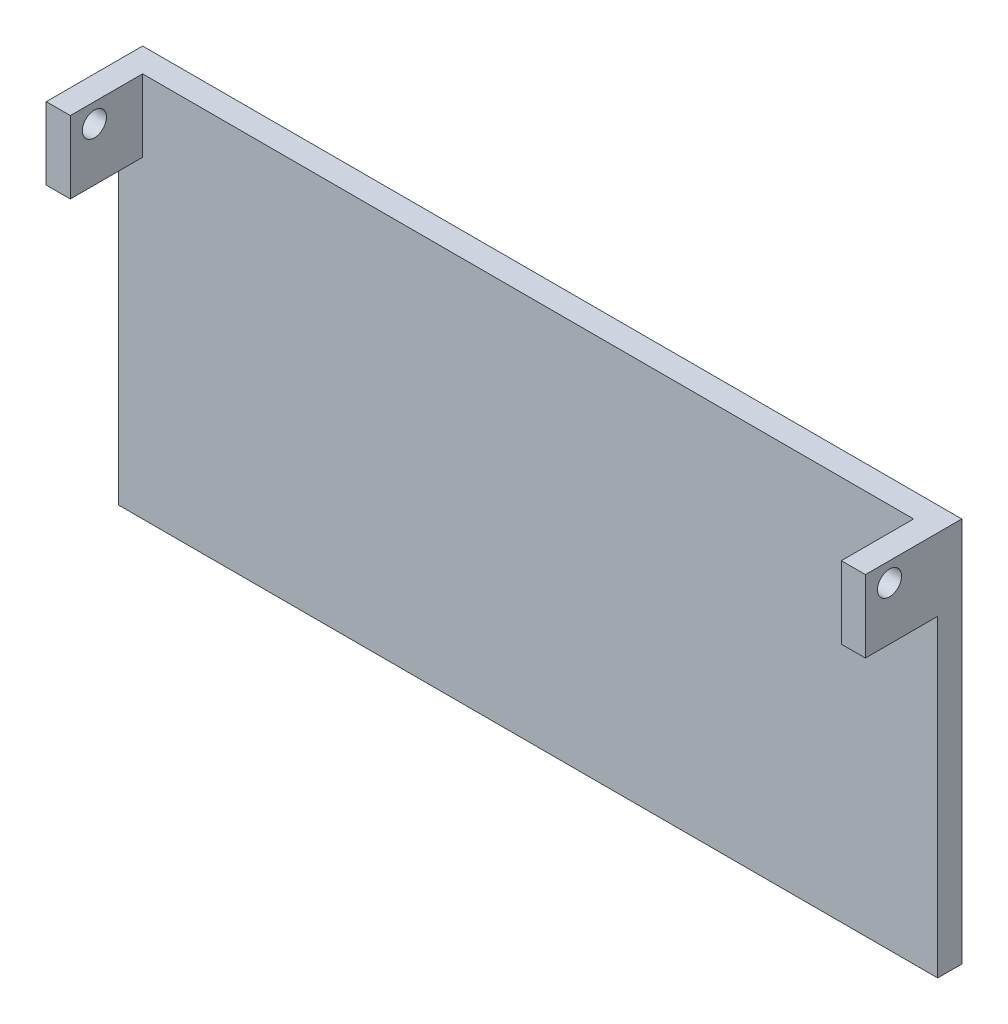
from build123d import *

# Parameters (mm, degrees)
SKETCH_1_W      = 170
SKETCH_1_H      = 80
EXTRUDE_1_DEPTH = 5
SKETCH_2_W      = 20
SKETCH_2_H      = 15
SKETCH_2_R      = 2.5
EXTRUDE_2_DEPTH = 5
EXTRUDE_START   = -5
SKETCH_3_W      = 20
SKETCH_3_H      = 15
SKETCH_3_R      = 2.5
EXTRUDE_3_DEPTH = 5


with BuildPart() as part:
    # 草图1 → 凸台-拉伸1 (new body)
    with BuildSketch(Plane.XY):
        with Locations((-2.943722944, -40)):
            Rectangle(SKETCH_1_W, SKETCH_1_H)
    extrude(amount=EXTRUDE_1_DEPTH)

    # 草图2 → 凸台-拉伸2 (add)
    with BuildSketch(Plane.ZY.offset(87.943722944)):
        with Locations((10, -7.5)):
            Rectangle(SKETCH_2_W, SKETCH_2_H)
        with Locations((15, -4)):
            Circle(SKETCH_2_R, mode=Mode.SUBTRACT)
    extrude(amount=-EXTRUDE_2_DEPTH)

    # 草图3 → 凸台-拉伸3 (add)
    with BuildSketch(Plane(origin=(82.056277056, 0, 0), x_dir=(0, 0, -1), z_dir=(1, 0, 0)).offset(EXTRUDE_START)):
        with Locations((-10, -7.5)):
            Rectangle(SKETCH_3_W, SKETCH_3_H)
        with Locations(Location((-15, -4, 0), (0, 0, 180))):
            Circle(SKETCH_3_R, mode=Mode.SUBTRACT)
    extrude(amount=EXTRUDE_3_DEPTH)


solid = part.part
